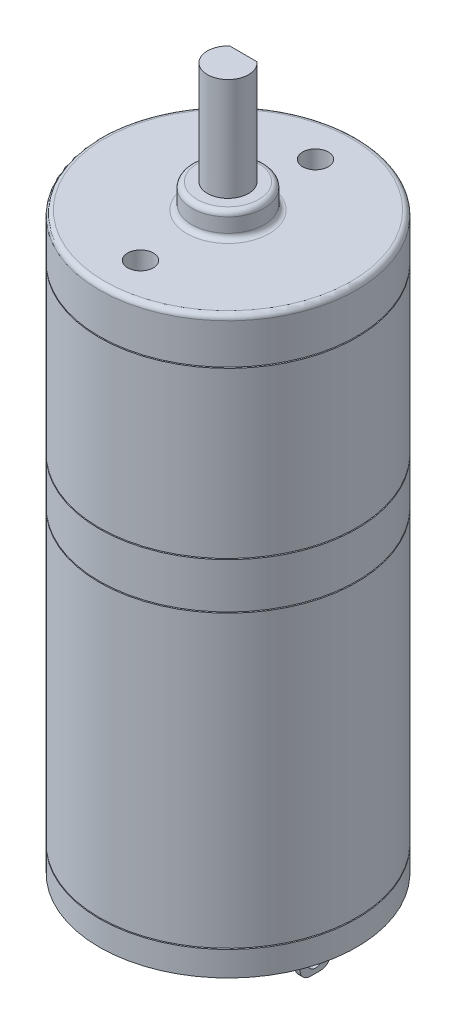
from build123d import *

# Parameters (mm, degrees)
SKETCH1_R            = 12.5
BOSS_EXTRUDE1_DEPTH  = 4.4
SKETCH2_R            = 12.15
BOSS_EXTRUDE2_DEPTH  = 0.1
BOSS_EXTRUDE3_START  = 16
SKETCH3_R            = 12.5
BOSS_EXTRUDE3_DEPTH  = 16
SKETCH4_R            = 12.15
BOSS_EXTRUDE4_DEPTH  = 0.1
BOSS_EXTRUDE5_START  = 4.4
SKETCH5_R            = 12.5
BOSS_EXTRUDE5_DEPTH  = 4.4
SKETCH6_R            = 12.15
BOSS_EXTRUDE6_DEPTH  = 0.1
BOSS_EXTRUDE7_START  = 28.2
SKETCH7_R            = 12.5
BOSS_EXTRUDE7_DEPTH  = 28.2
SKETCH8_R            = 12.15
BOSS_EXTRUDE8_DEPTH  = 0.1
BOSS_EXTRUDE9_START  = 2.4
SKETCH9_R            = 12.5
BOSS_EXTRUDE9_DEPTH  = 2.4
SKETCH10_R           = 11.5
CUT_EXTRUDE1_DEPTH   = 0.8
SKETCH11_W           = 0.5
SKETCH11_H           = 3
BOSS_EXTRUDE10_DEPTH = 5
SKETCH12_R           = 0.75
CUT_EXTRUDE2_DEPTH   = 61.733927915
FILLET1_R            = 1
SKETCH13_R           = 1.25
CUT_EXTRUDE3_DEPTH   = 8
SKETCH14_R           = 3.5
BOSS_EXTRUDE11_DEPTH = 2.38
SKETCH15_R           = 2
BOSS_EXTRUDE12_DEPTH = 10
CUT_EXTRUDE4_START   = -8
CUT_EXTRUDE4_DEPTH   = 8
FILLET2_R            = 0.5


with BuildPart() as part:
    # Sketch1 → Boss-Extrude1 (new body)
    with BuildSketch(Plane(origin=(0, 0, 0), x_dir=(1, 0, 0), z_dir=(0, 1, 0))):
        with Locations(Location((0, 0, 0), (0, 0, 270))):
            Circle(SKETCH1_R)
    extrude(amount=BOSS_EXTRUDE1_DEPTH)

    # Sketch2 → Boss-Extrude2 (add)
    with BuildSketch(Plane.XZ):
        with Locations(Location((0, 0, 0), (0, 0, 270))):
            Circle(SKETCH2_R)
    extrude(amount=BOSS_EXTRUDE2_DEPTH)

    # Sketch3 → Boss-Extrude3 (add)
    with BuildSketch(Plane.XZ.offset(0.1).offset(BOSS_EXTRUDE3_START)):
        with Locations(Location((0, 0, 0), (0, 0, 90))):
            Circle(SKETCH3_R)
    extrude(amount=-BOSS_EXTRUDE3_DEPTH)

    # Sketch4 → Boss-Extrude4 (add)
    with BuildSketch(Plane.XZ.offset(16.1)):
        with Locations(Location((0, 0, 0), (0, 0, 270))):
            Circle(SKETCH4_R)
    extrude(amount=BOSS_EXTRUDE4_DEPTH)

    # Sketch5 → Boss-Extrude5 (add)
    with BuildSketch(Plane.XZ.offset(16.2).offset(BOSS_EXTRUDE5_START)):
        with Locations(Location((0, 0, 0), (0, 0, 90))):
            Circle(SKETCH5_R)
    extrude(amount=-BOSS_EXTRUDE5_DEPTH)

    # Sketch6 → Boss-Extrude6 (add)
    with BuildSketch(Plane.XZ.offset(20.6)):
        with Locations(Location((0, 0, 0), (0, 0, 270))):
            Circle(SKETCH6_R)
    extrude(amount=BOSS_EXTRUDE6_DEPTH)

    # Sketch7 → Boss-Extrude7 (add)
    with BuildSketch(Plane.XZ.offset(20.7).offset(BOSS_EXTRUDE7_START)):
        with Locations(Location((0, 0, 0), (0, 0, 90))):
            Circle(SKETCH7_R)
    extrude(amount=-BOSS_EXTRUDE7_DEPTH)

    # Sketch8 → Boss-Extrude8 (add)
    with BuildSketch(Plane.XZ.offset(48.9)):
        with Locations(Location((0, 0, 0), (0, 0, 270))):
            Circle(SKETCH8_R)
    extrude(amount=BOSS_EXTRUDE8_DEPTH)

    # Sketch9 → Boss-Extrude9 (add)
    with BuildSketch(Plane.XZ.offset(49).offset(BOSS_EXTRUDE9_START)):
        with Locations(Location((0, 0, 0), (0, 0, 90))):
            Circle(SKETCH9_R)
    extrude(amount=-BOSS_EXTRUDE9_DEPTH)

    # Sketch10 → Cut-Extrude1 (cut)
    with BuildSketch(Plane.XZ.offset(51.4)):
        with Locations(Location((0, 0, 0), (0, 0, 270))):
            Circle(SKETCH10_R)
    extrude(amount=-CUT_EXTRUDE1_DEPTH, mode=Mode.SUBTRACT)

    # Sketch11 → Boss-Extrude10 (add)
    with BuildSketch(Plane.XZ.offset(50.6)):
        with Locations((-8.25, 0)):
            Rectangle(SKETCH11_W, SKETCH11_H)
        with Locations((8.25, 0)):
            Rectangle(SKETCH11_W, SKETCH11_H)
    extrude(amount=BOSS_EXTRUDE10_DEPTH)

    # Sketch12 → Cut-Extrude2 (cut, through all)
    with BuildSketch(Plane(origin=(8.5, 0, 0), x_dir=(0, 0, -1), z_dir=(1, 0, 0))):
        with Locations((0, -54.4)):
            Circle(SKETCH12_R)
    extrude(amount=-CUT_EXTRUDE2_DEPTH, mode=Mode.SUBTRACT)

    # Fillet1
    fillet1_edges = [part.edges().sort_by_distance(p)[0] for p in [
        (-8.25, -55.6, 1.5),
        (-8.25, -55.6, -1.5),
        (8.25, -55.6, -1.5),
        (8.25, -55.6, 1.5),
    ]]
    fillet(fillet1_edges, radius=FILLET1_R)

    # Sketch13 → Cut-Extrude3 (cut)
    with BuildSketch(Plane(origin=(0, 4.4, 0), x_dir=(1, 0, 0), z_dir=(0, 1, 0))):
        with Locations(Location((0, 8.5, 0), (0, 0, 270))):
            Circle(SKETCH13_R)
        with Locations(Location((0, -8.5, 0), (0, 0, 90))):
            Circle(SKETCH13_R)
    extrude(amount=-CUT_EXTRUDE3_DEPTH, mode=Mode.SUBTRACT)

    # Sketch14 → Boss-Extrude11 (add)
    with BuildSketch(Plane(origin=(0, 4.4, 0), x_dir=(1, 0, 0), z_dir=(0, 1, 0))):
        with Locations(Location((0, 0, 0), (0, 0, 270))):
            Circle(SKETCH14_R)
    extrude(amount=BOSS_EXTRUDE11_DEPTH)

    # Sketch15 → Boss-Extrude12 (add)
    with BuildSketch(Plane(origin=(0, 6.78, 0), x_dir=(1, 0, 0), z_dir=(0, 1, 0))):
        with Locations(Location((0, 0, 0), (0, 0, 270))):
            Circle(SKETCH15_R)
    extrude(amount=BOSS_EXTRUDE12_DEPTH)

    # Sketch16 → Cut-Extrude4 (cut)
    with BuildSketch(Plane(origin=(0, 16.78, 0), x_dir=(1, 0, 0), z_dir=(0, 1, 0)).offset(CUT_EXTRUDE4_START)):
        with BuildLine():
            Line((-1.322875656, 1.5), (1.322875656, 1.5))
            ThreePointArc((1.322875656, 1.5), (0, 2), (-1.322875656, 1.5))
        make_face()
    extrude(amount=CUT_EXTRUDE4_DEPTH, mode=Mode.SUBTRACT)

    # Fillet2
    fillet2_edges = [part.edges().sort_by_distance(p)[0] for p in [
        (0, 4.4, -3.5),
        (0, 6.78, -3.5),
        (0, 4.4, -12.5),
    ]]
    fillet(fillet2_edges, radius=FILLET2_R)


solid = part.part
